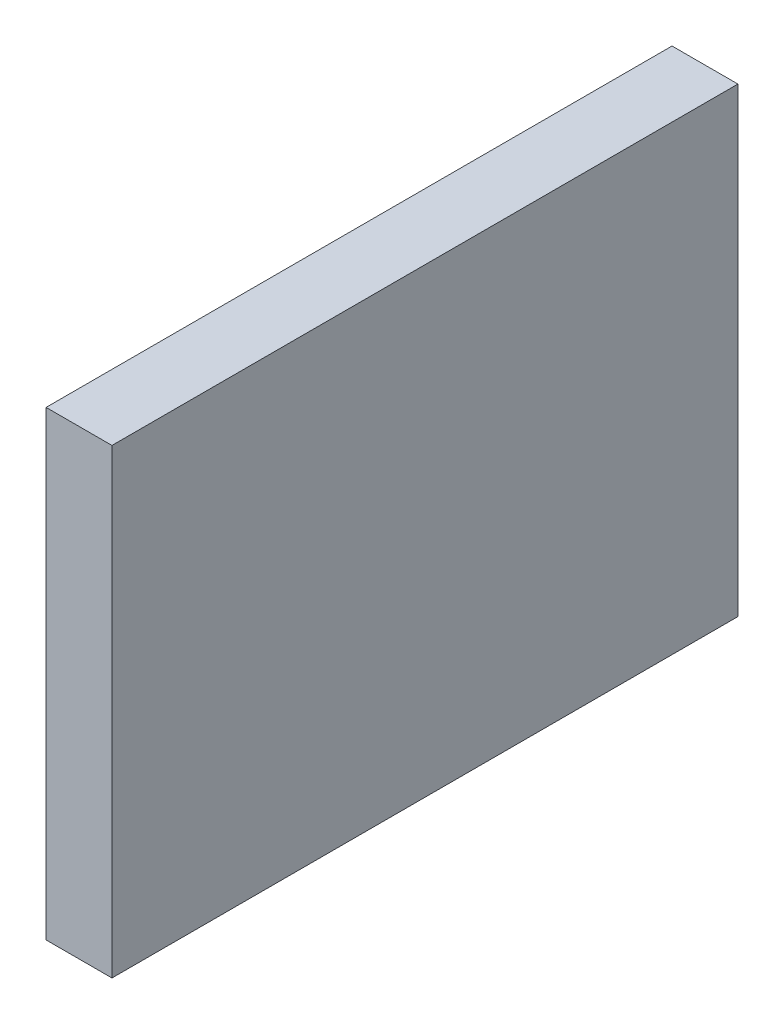
from build123d import *

# Parameters (mm, degrees)
SKETCH1_W           = 2
SKETCH1_H           = 14
BOSS_EXTRUDE1_DEPTH = 23
SKETCH2_W           = 2
SKETCH2_H           = 14
CUT_EXTRUDE1_DEPTH  = 10
CUT_EXTRUDE2_DEPTH  = 10


with BuildPart() as part:
    # Sketch1 → Boss-Extrude1 (new body)
    with BuildSketch(Plane.XY):
        Rectangle(SKETCH1_W, SKETCH1_H)
    extrude(amount=BOSS_EXTRUDE1_DEPTH)

    # Sketch2 → Cut-Extrude1 (cut)
    with BuildSketch(Plane.ZY.offset(1)):
        with Locations((1, 0)):
            Rectangle(SKETCH2_W, SKETCH2_H)
    extrude(amount=-CUT_EXTRUDE1_DEPTH, mode=Mode.SUBTRACT)

    # Sketch3 → Cut-Extrude2 (cut)
    with BuildSketch(Plane.ZY.offset(1)):
        Polygon((4, 7), (4, -7), (2, -7), (2, 7), (3.440196678, 7), align=None)
    extrude(amount=-CUT_EXTRUDE2_DEPTH, mode=Mode.SUBTRACT)


solid = part.part
